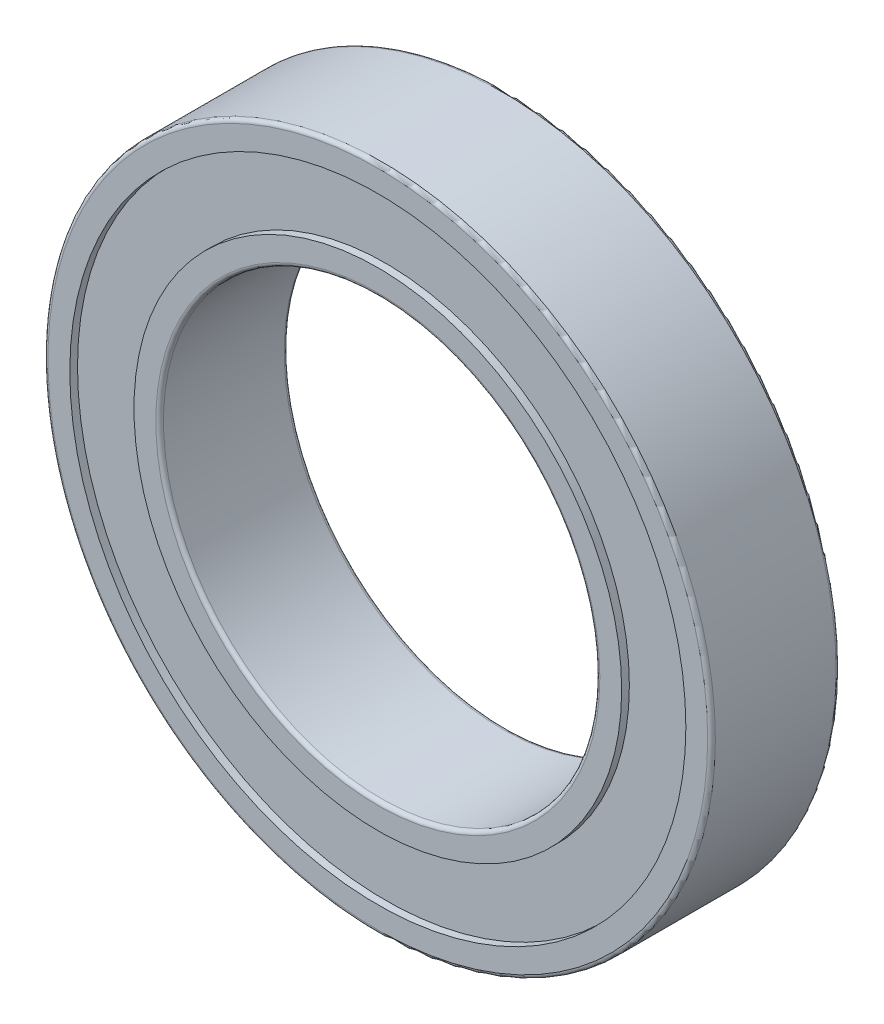
from build123d import *

# Parameters (mm, degrees)
SKETCH1_R           = 13
SKETCH1_R_2         = 8.5
BOSS_EXTRUDE1_DEPTH = 5
SKETCH2_R           = 12
SKETCH2_R_2         = 9.5
CUT_EXTRUDE1_DEPTH  = 0.3
CUT_EXTRUDE2_START  = -4.5
SKETCH2_2_R         = 12
SKETCH2_2_R_2       = 9.5
CUT_EXTRUDE2_DEPTH  = 0.5
FILLET1_R           = 0.15


with BuildPart() as part:
    # Sketch1 → Boss-Extrude1 (new body)
    with BuildSketch(Plane.XY):
        Circle(SKETCH1_R)
        Circle(SKETCH1_R_2, mode=Mode.SUBTRACT)
    extrude(amount=BOSS_EXTRUDE1_DEPTH)

    # Sketch2 → Cut-Extrude1 (cut)
    with BuildSketch(Plane.XY.offset(5)):
        Circle(SKETCH2_R)
        Circle(SKETCH2_R_2, mode=Mode.SUBTRACT)
    extrude(amount=-CUT_EXTRUDE1_DEPTH, mode=Mode.SUBTRACT)

    # Sketch2<2> → Cut-Extrude2 (cut)
    with BuildSketch(Plane.XY.offset(5).offset(CUT_EXTRUDE2_START)):
        Circle(SKETCH2_2_R)
        Circle(SKETCH2_2_R_2, mode=Mode.SUBTRACT)
    extrude(amount=-CUT_EXTRUDE2_DEPTH, mode=Mode.SUBTRACT)

    # Fillet1
    fillet1_edges = [part.edges().sort_by_distance(p)[0] for p in [
        (-13, 0, 0),
        (-13, 0, 5),
        (-8.5, 0, 0),
        (-8.5, 0, 5),
    ]]
    fillet(fillet1_edges, radius=FILLET1_R)


solid = part.part
